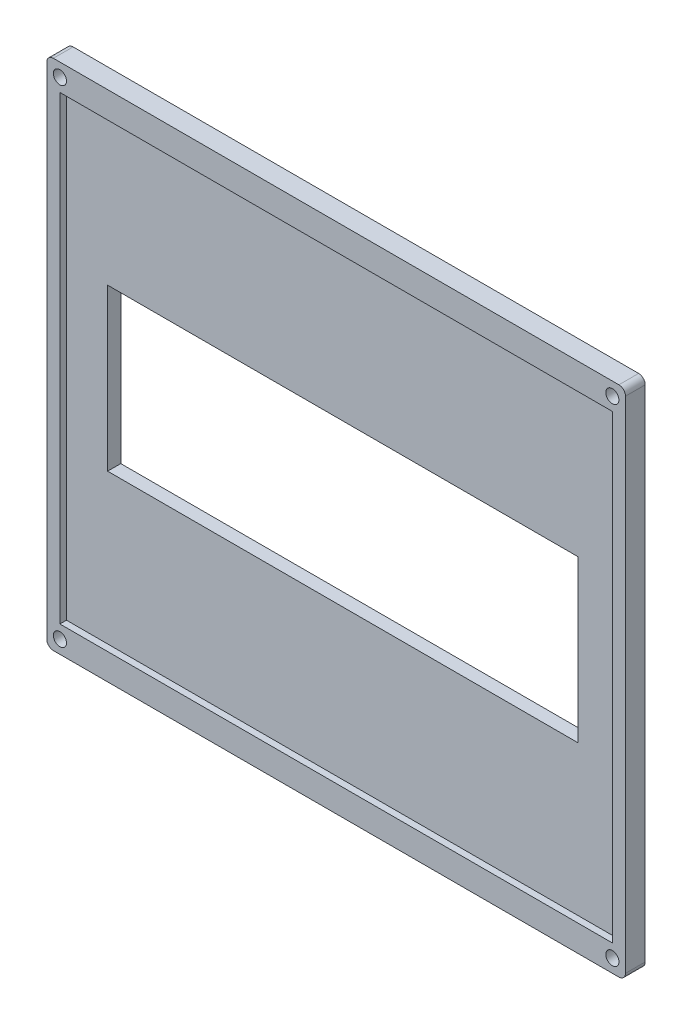
from build123d import *

# Parameters (mm, degrees)
SKETCH2_W           = 88
SKETCH2_H           = 78
BOSS_EXTRUDE1_DEPTH = 3
SKETCH3_W           = 84
SKETCH3_H           = 70
CUT_EXTRUDE1_DEPTH  = 1
SKETCH4_R           = 1
CUT_EXTRUDE2_DEPTH  = 3
FILLET1_R           = 1
SKETCH5_W           = 71.5
SKETCH5_H           = 24.5
CUT_EXTRUDE3_DEPTH  = 3


with BuildPart() as part:
    # Sketch2 → Boss-Extrude1 (new body)
    with BuildSketch(Plane.XY):
        Rectangle(SKETCH2_W, SKETCH2_H)
    extrude(amount=BOSS_EXTRUDE1_DEPTH)

    # Sketch3 → Cut-Extrude1 (cut)
    with BuildSketch(Plane.XY.offset(3)):
        Rectangle(SKETCH3_W, SKETCH3_H)
    extrude(amount=-CUT_EXTRUDE1_DEPTH, mode=Mode.SUBTRACT)

    # Sketch4 → Cut-Extrude2 (cut)
    with BuildSketch(Plane.XY.offset(3)):
        with Locations((-42, 37)):
            Circle(SKETCH4_R)
        with Locations((42, 37)):
            Circle(SKETCH4_R)
        with Locations((-42, -37)):
            Circle(SKETCH4_R)
        with Locations((42, -37)):
            Circle(SKETCH4_R)
    extrude(amount=-CUT_EXTRUDE2_DEPTH, mode=Mode.SUBTRACT)

    # Fillet1
    fillet1_edges = [part.edges().sort_by_distance(p)[0] for p in [
        (-44, -39, 1.5),
        (-44, 39, 1.5),
        (44, 39, 1.5),
        (44, -39, 1.5),
    ]]
    fillet(fillet1_edges, radius=FILLET1_R)

    # Sketch5 → Cut-Extrude3 (cut)
    with BuildSketch(Plane.XY.offset(2)):
        Rectangle(SKETCH5_W, SKETCH5_H)
    extrude(amount=-CUT_EXTRUDE3_DEPTH, mode=Mode.SUBTRACT)


solid = part.part
